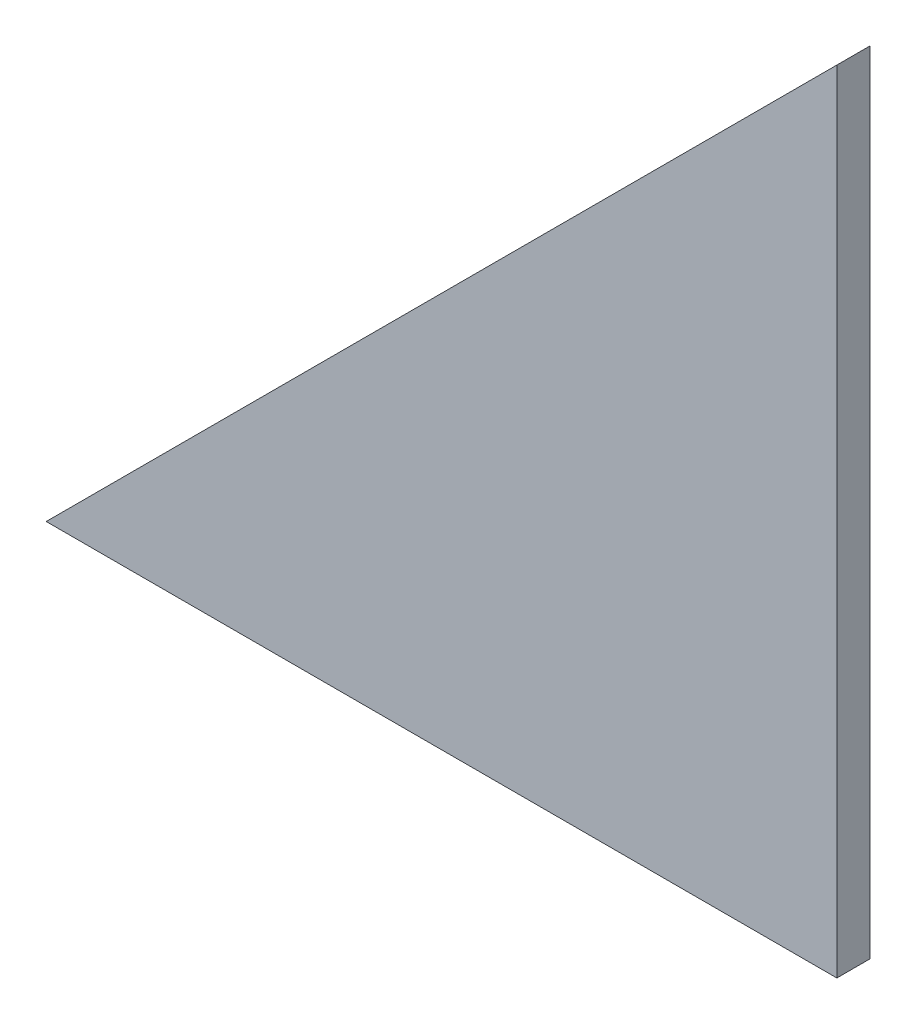
from build123d import *

# Parameters (mm, degrees)
BOSS_EXTRUDE1_DEPTH = 3.175


with BuildPart() as part:
    # Sketch1 → Boss-Extrude1 (new body)
    with BuildSketch(Plane.XY):
        Polygon((0, 0), (76.2, 0), (76.2, 76.2), align=None)
    extrude(amount=BOSS_EXTRUDE1_DEPTH)


solid = part.part
